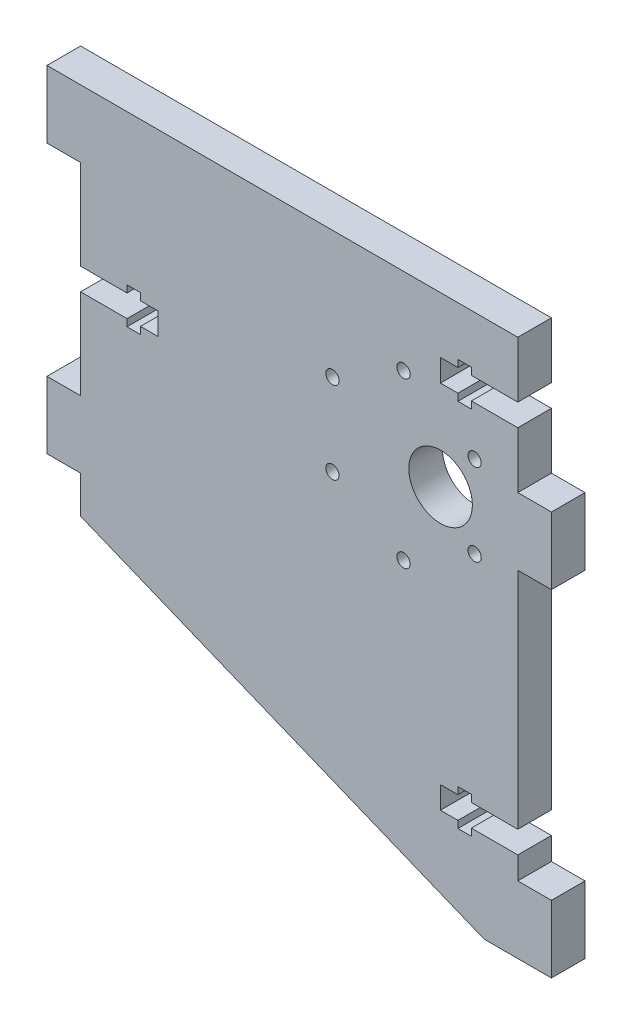
from build123d import *

# Parameters (mm, degrees)
BOSS_EXTRUDE1_DEPTH = 6.35
SKETCH2_W           = 6.35
SKETCH2_H           = 12.7
BOSS_EXTRUDE2_DEPTH = 6.35
LPATTERN1_COUNT     = 2
LPATTERN1_PITCH     = 63.5
SKETCH3_R           = 1.25
SKETCH3_R_2         = 6
CUT_EXTRUDE1_DEPTH  = 93.937051949
SKETCH4_W           = 6.35
SKETCH4_H           = 12.7
SKETCH4_H_2         = 12.666633789
BOSS_EXTRUDE3_DEPTH = 6.35
CUT_EXTRUDE2_DEPTH  = 98.221400036


with BuildPart() as part:
    # Sketch1 → Boss-Extrude1 (new body)
    with BuildSketch(Plane.XY):
        Polygon((-60.975, 31.75), (21.575, 31.75), (21.575, -38.788945114), (21.575, -69.85), (15.225, -69.85), (-60.975, -38.788945114), align=None)
    extrude(amount=BOSS_EXTRUDE1_DEPTH)

    # Sketch2 → Boss-Extrude2 (add)
    with BuildSketch(Plane(origin=(21.575, 0, 0), x_dir=(0, 0, -1), z_dir=(1, 0, 0))):
        with Locations((-3.175, -63.5)):
            Rectangle(SKETCH2_W, SKETCH2_H)
    boss_extrude2 = extrude(amount=BOSS_EXTRUDE2_DEPTH)

    # LPattern1: Boss-Extrude2 ×2
    with Locations(*[(0, i * LPATTERN1_PITCH, 0) for i in range(1, LPATTERN1_COUNT)]):
        add(boss_extrude2)

    # Sketch3 → Cut-Extrude1 (cut, through all)
    with BuildSketch(Plane(origin=(0, 0, 0), x_dir=(-1, 0, 0), z_dir=(0, 0, -1))):
        with Locations((13.423393759, 7.75)):
            Circle(SKETCH3_R)
        with Locations((13.423393759, -7.75)):
            Circle(SKETCH3_R)
        with Locations((0, 15.5)):
            Circle(SKETCH3_R)
        with Locations((-13.423393759, 7.75)):
            Circle(SKETCH3_R)
        with Locations((-13.423393759, -7.75)):
            Circle(SKETCH3_R)
        with Locations((0, -15.5)):
            Circle(SKETCH3_R)
        with Locations((-7, 0)):
            Circle(SKETCH3_R_2)
    extrude(amount=-CUT_EXTRUDE1_DEPTH, mode=Mode.SUBTRACT)

    # Sketch4 → Boss-Extrude3 (add)
    with BuildSketch(Plane.ZY.offset(60.975)):
        with Locations((3.175, 25.4)):
            Rectangle(SKETCH4_W, SKETCH4_H)
        with Locations((3.175, -25.416683106)):
            Rectangle(SKETCH4_W, SKETCH4_H_2)
    extrude(amount=BOSS_EXTRUDE3_DEPTH)

    # Sketch5 → Cut-Extrude2 (cut, through all)
    with BuildSketch(Plane.XY.offset(6.35)):
        Polygon((-60.975, 2.0955), (-60.975, -2.0955), (-52.212, -2.0955), (-52.212, -3.429), (-49.672, -3.429), (-49.672, -2.0955), (-46.37, -2.0955), (-46.37, 2.0955), (-49.672, 2.0955), (-49.672, 3.429), (-52.212, 3.429), (-52.212, 2.0955), align=None)
        Polygon((21.575, -52.8955), (21.575, -48.7045), (12.812, -48.7045), (12.812, -47.371), (10.272, -47.371), (10.272, -48.7045), (6.97, -48.7045), (6.97, -52.8955), (10.272, -52.8955), (10.272, -54.229), (12.812, -54.229), (12.812, -52.8955), align=None)
        Polygon((21.575, 16.9545), (21.575, 21.1455), (12.812, 21.1455), (12.812, 22.479), (10.272, 22.479), (10.272, 21.1455), (6.97, 21.1455), (6.97, 16.9545), (10.272, 16.9545), (10.272, 15.621), (12.812, 15.621), (12.812, 16.9545), align=None)
    extrude(amount=-CUT_EXTRUDE2_DEPTH, mode=Mode.SUBTRACT)


solid = part.part
